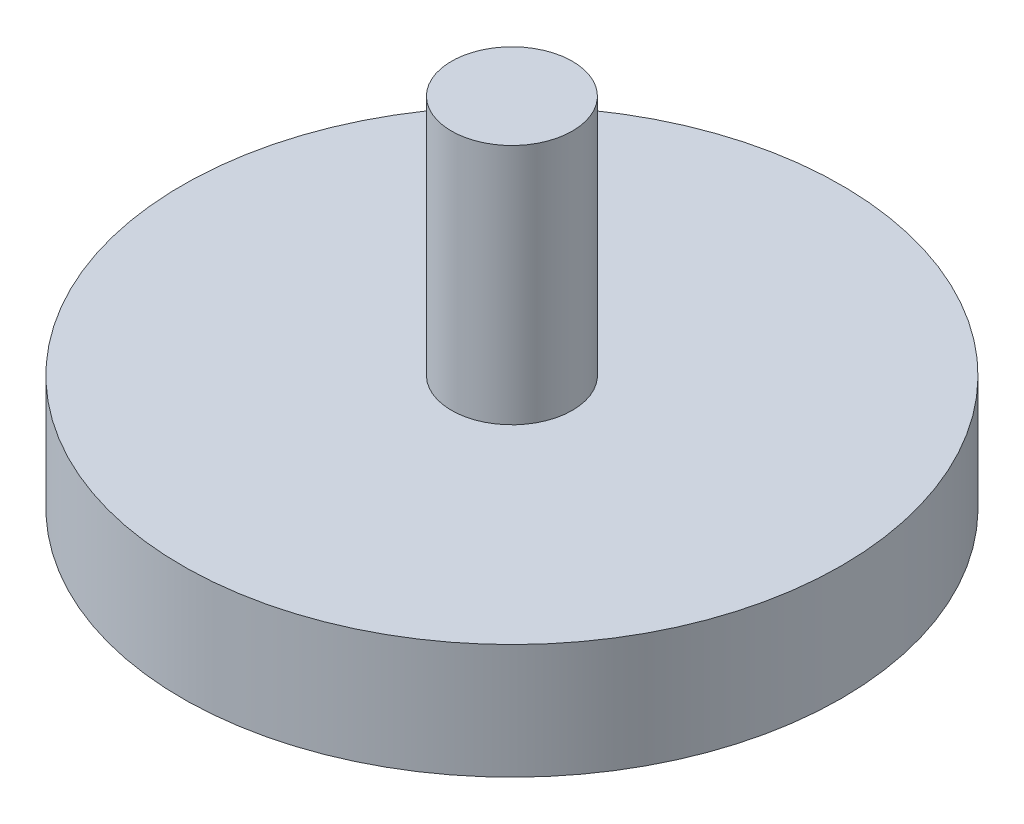
from build123d import *

# Parameters (mm, degrees)
FORO_LAMATO_PER_BULLONE_M5_A_TESTA_ESAGO_D           = 5.5
FORO_LAMATO_PER_BULLONE_M5_A_TESTA_ESAGO_DEPTH       = 48
FORO_LAMATO_PER_BULLONE_M5_A_TESTA_ESAGO_CBORE_D     = 12.238
FORO_LAMATO_PER_BULLONE_M5_A_TESTA_ESAGO_CBORE_DEPTH = 3.5
FORO_LAMATO_PER_BULLONE_M5_A_TESTA_ESAGO_TIP         = 1.652366702


with BuildPart() as part:
    # Schizzo1 → Rivoluzione1 (revolve)
    with BuildSketch(Plane.XY):
        Polygon((20, 68), (109, 68), (109, 30), (30, 30), (30, 5), (48, 5), (48, 0), (0, 0), (0, 148), (20, 148), align=None)
    revolve(axis=Axis((0, -1000, 0), (0, 1, 0)))

    # Foro lamato per Bullone M5 a testa esagonale-1
    with Locations(Plane(origin=(0, 0, 0), x_dir=(-1, 0, 0), z_dir=(0, -1, 0))):
        with Locations((0, 38), (-38, 0), (0, -38), (38, 0)):
            CounterBoreHole(FORO_LAMATO_PER_BULLONE_M5_A_TESTA_ESAGO_D / 2, FORO_LAMATO_PER_BULLONE_M5_A_TESTA_ESAGO_CBORE_D / 2, FORO_LAMATO_PER_BULLONE_M5_A_TESTA_ESAGO_CBORE_DEPTH, depth=FORO_LAMATO_PER_BULLONE_M5_A_TESTA_ESAGO_DEPTH)
            with Locations((0, 0, -(FORO_LAMATO_PER_BULLONE_M5_A_TESTA_ESAGO_DEPTH + FORO_LAMATO_PER_BULLONE_M5_A_TESTA_ESAGO_TIP / 2))):  # 118° drill point
                Cone(0, FORO_LAMATO_PER_BULLONE_M5_A_TESTA_ESAGO_D / 2, FORO_LAMATO_PER_BULLONE_M5_A_TESTA_ESAGO_TIP, mode=Mode.SUBTRACT)


solid = part.part
